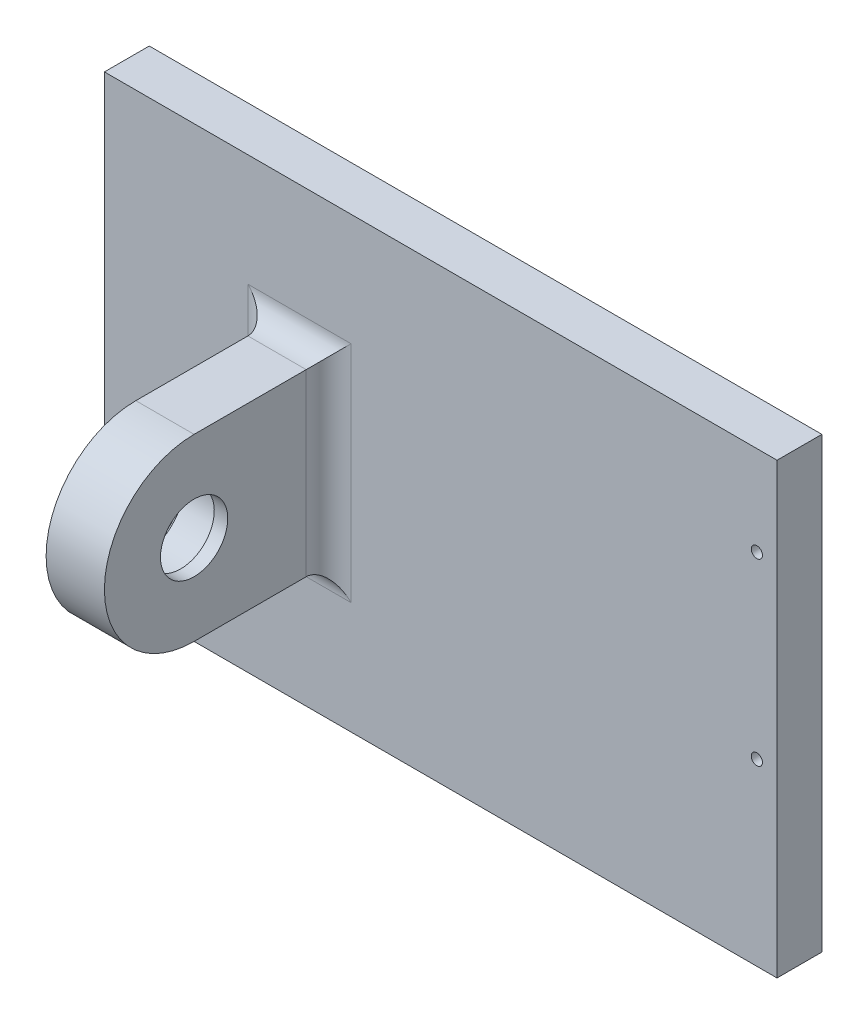
from build123d import *

# Parameters (mm, degrees)
SKETCH_2_W          = 150
SKETCH_2_H          = 100
EXTRUDE_1_DEPTH     = 10
SKETCH_3_W          = 13
SKETCH_3_H          = 40
EXTRUDE_2_DEPTH     = 40
SKETCH_4_R          = 20
EXTRUDE_3_DEPTH     = 13
SKETCH_5_R          = 10
CUT_EXTRUDE_1_DEPTH = 10
M3X0_5_2_D          = 2.5
FILLET_1_R          = 5
SKETCH_12_R         = 7.5
CUT_EXTRUDE_2_DEPTH = 130.263297188
CHAMFER_1_SIZE      = 1


with BuildPart() as part:
    # ｽｹｯﾁ2 → ﾎﾞｽ - 押し出し1 (new body)
    with BuildSketch(Plane.XY):
        Rectangle(SKETCH_2_W, SKETCH_2_H)
    extrude(amount=EXTRUDE_1_DEPTH)

    # ｽｹｯﾁ3 → ﾎﾞｽ - 押し出し2 (add)
    with BuildSketch(Plane.XY):
        with Locations((-31.5, 0)):
            Rectangle(SKETCH_3_W, SKETCH_3_H)
    extrude(amount=EXTRUDE_2_DEPTH)

    # ｽｹｯﾁ4 → ﾎﾞｽ - 押し出し3 (add)
    with BuildSketch(Plane.ZY.offset(38)):
        with Locations((40, 0)):
            Circle(SKETCH_4_R)
    extrude(amount=-EXTRUDE_3_DEPTH)

    # ｽｹｯﾁ5 → ｶｯﾄ - 押し出し1 (cut)
    with BuildSketch(Plane.ZY.offset(38)):
        with Locations(Location((40, 0, 0), (0, 0, 270))):
            Circle(SKETCH_5_R)
    extrude(amount=-CUT_EXTRUDE_1_DEPTH, mode=Mode.SUBTRACT)

    # M3x0.5 ねじ穴2 (through all)
    with Locations(Plane.XY.offset(10)):
        with Locations((70.5, -10.000898701), (70.5, 29.999101299)):
            Hole(M3X0_5_2_D / 2)

    # ﾌｨﾚｯﾄ1
    fillet_1_edges = [part.edges().sort_by_distance(p)[0] for p in [
        (-31.5, 20, 10),
        (-38, 0, 10),
        (-31.5, -20, 10),
        (-25, 0, 10),
    ]]
    fillet(fillet_1_edges, radius=FILLET_1_R)

    # ｽｹｯﾁ12 → ｶｯﾄ - 押し出し2 (cut, through all)
    with BuildSketch(Plane.ZY.offset(28)):
        with Locations(Location((40, 0, 0), (0, 0, 270))):
            Circle(SKETCH_12_R)
    extrude(amount=-CUT_EXTRUDE_2_DEPTH, mode=Mode.SUBTRACT)

    # 面取り1
    chamfer_1_edges = [part.edges().sort_by_distance(p)[0] for p in [
        (-38, 10, 40),
    ]]
    chamfer(chamfer_1_edges, length=CHAMFER_1_SIZE)


solid = part.part
